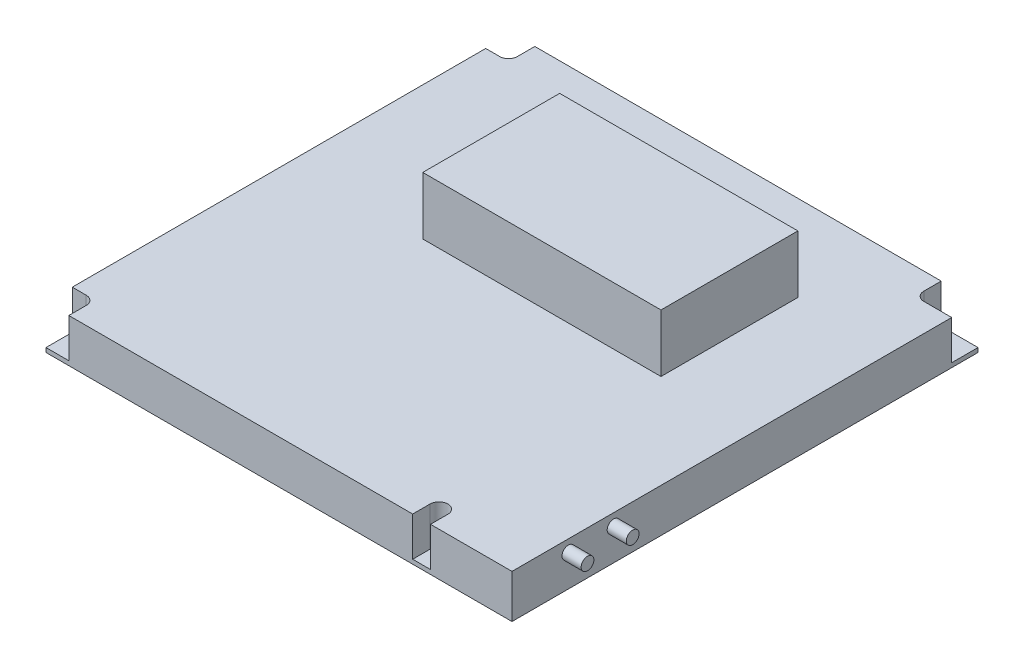
from build123d import *

# Parameters (mm, degrees)
SKETCH1_W           = 170.18
SKETCH1_H           = 170.18
SKETCH1_R           = 1.9750024
SKETCH1_R_2         = 1.974999987
BOSS_EXTRUDE1_DEPTH = 15.875
CUT_EXTRUDE1_DEPTH  = 14.300000102
SKETCH4_W           = 86.99999999
SKETCH4_H           = 50.000000076
BOSS_EXTRUDE2_DEPTH = 21.048998796
SKETCH5_R           = 2.325000049
BOSS_EXTRUDE3_DEPTH = 6.99999997


with BuildPart() as part:
    # Sketch1 → Boss-Extrude1 (new body)
    with BuildSketch(Plane(origin=(0, 0, 0), x_dir=(1, 0, 0), z_dir=(0, 1, 0))):
        Rectangle(SKETCH1_W, SKETCH1_H)
        with Locations(Location((-80.01, 78.74, 0), (0, 0, 270))):
            Circle(SKETCH1_R, mode=Mode.SUBTRACT)
        with Locations(Location((74.91000004, 78.74, 0), (0, 0, 270))):
            Circle(SKETCH1_R, mode=Mode.SUBTRACT)
        with Locations(Location((-80.01, -78.74, 0), (0, 0, 270))):
            Circle(SKETCH1_R, mode=Mode.SUBTRACT)
        with Locations(Location((52.07, -78.74, 0), (0, 0, 270))):
            Circle(SKETCH1_R_2, mode=Mode.SUBTRACT)
    extrude(amount=BOSS_EXTRUDE1_DEPTH)

    # Sketch3 → Cut-Extrude1 (cut)
    with BuildSketch(Plane(origin=(0, 15.875, 0), x_dir=(1, 0, 0), z_dir=(0, 1, 0))):
        with BuildLine():
            Line((-76.7588, 78.74), (-76.7588, 85.09))
            Line((-76.7588, 85.09), (-85.09, 85.09))
            Line((-85.09, 85.09), (-85.09, 75.4888))
            Line((-85.09, 75.4888), (-80.01, 75.4888))
            ThreePointArc((-80.01, 75.4888), (-77.711054433, 76.441054433), (-76.7588, 78.74))
        make_face()
        with BuildLine():
            Line((71.65880004, 78.74), (71.65880004, 85.09))
            Line((71.65880004, 85.09), (85.09, 85.09))
            Line((85.09, 85.09), (85.09, 75.4888))
            Line((85.09, 75.4888), (74.91000004, 75.4888))
            ThreePointArc((74.91000004, 75.4888), (72.611054473, 76.441054433), (71.65880004, 78.74))
        make_face()
        with BuildLine():
            Line((48.8188, -78.74), (48.8188, -85.09))
            Line((48.8188, -85.09), (55.3212, -85.09))
            Line((55.3212, -85.09), (55.3212, -78.74))
            ThreePointArc((55.3212, -78.74), (52.07, -75.4888), (48.8188, -78.74))
        make_face()
        with BuildLine():
            Line((-80.01, -75.4888), (-85.09, -75.4888))
            Line((-85.09, -75.4888), (-85.09, -85.09))
            Line((-85.09, -85.09), (-76.7588, -85.09))
            Line((-76.7588, -85.09), (-76.7588, -78.74))
            ThreePointArc((-76.7588, -78.74), (-77.711054433, -76.441054433), (-80.01, -75.4888))
        make_face()
    extrude(amount=-CUT_EXTRUDE1_DEPTH, mode=Mode.SUBTRACT)

    # Sketch4 → Boss-Extrude2 (add)
    with BuildSketch(Plane(origin=(0, 15.875, 0), x_dir=(1, 0, 0), z_dir=(0, 1, 0))):
        with Locations((7.169000013, 28.739999924)):
            Rectangle(SKETCH4_W, SKETCH4_H)
    extrude(amount=BOSS_EXTRUDE2_DEPTH)

    # Sketch5 → Boss-Extrude3 (add)
    with BuildSketch(Plane(origin=(85.09, 0, 0), x_dir=(0, 0, -1), z_dir=(1, 0, 0))):
        with Locations(Location((-64.510000012, 11.574999964, 0), (0, 0, 180))):
            Circle(SKETCH5_R)
        with Locations(Location((-48.009999992, 11.574999964, 0), (0, 0, 180))):
            Circle(SKETCH5_R)
    extrude(amount=BOSS_EXTRUDE3_DEPTH)


solid = part.part
